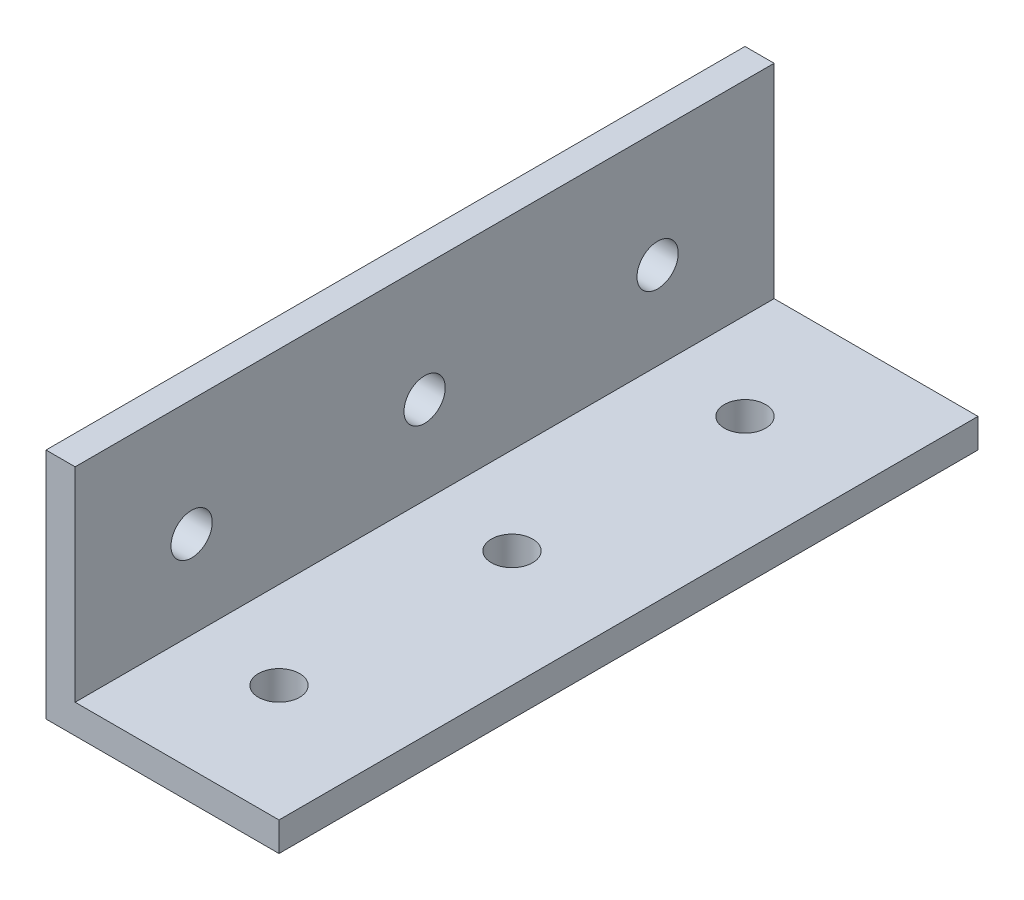
from build123d import *

# Parameters (mm, degrees)
BOSS_EXTRUDE1_DEPTH   = 76.2
F_8_CLEARANCE_HOLE1_D = 4.4958
F_8_CLEARANCE_HOLE2_D = 4.4958


with BuildPart() as part:
    # Sketch1 → Boss-Extrude1 (new body)
    with BuildSketch(Plane.XY):
        Polygon((0, 0), (25.4, 0), (25.4, 3.175), (3.175, 3.175), (3.175, 25.4), (0, 25.4), align=None)
    extrude(amount=BOSS_EXTRUDE1_DEPTH)

    # #8 Clearance Hole1 (through all)
    with Locations(Plane.XZ):
        with Locations((12.7, 63.5), (12.7, 38.1), (12.7, 12.7)):
            Hole(F_8_CLEARANCE_HOLE1_D / 2)

    # #8 Clearance Hole2 (through all)
    with Locations(Plane.ZY):
        with Locations((63.5, 12.7), (38.1, 12.7), (12.7, 12.7)):
            Hole(F_8_CLEARANCE_HOLE2_D / 2)


solid = part.part
